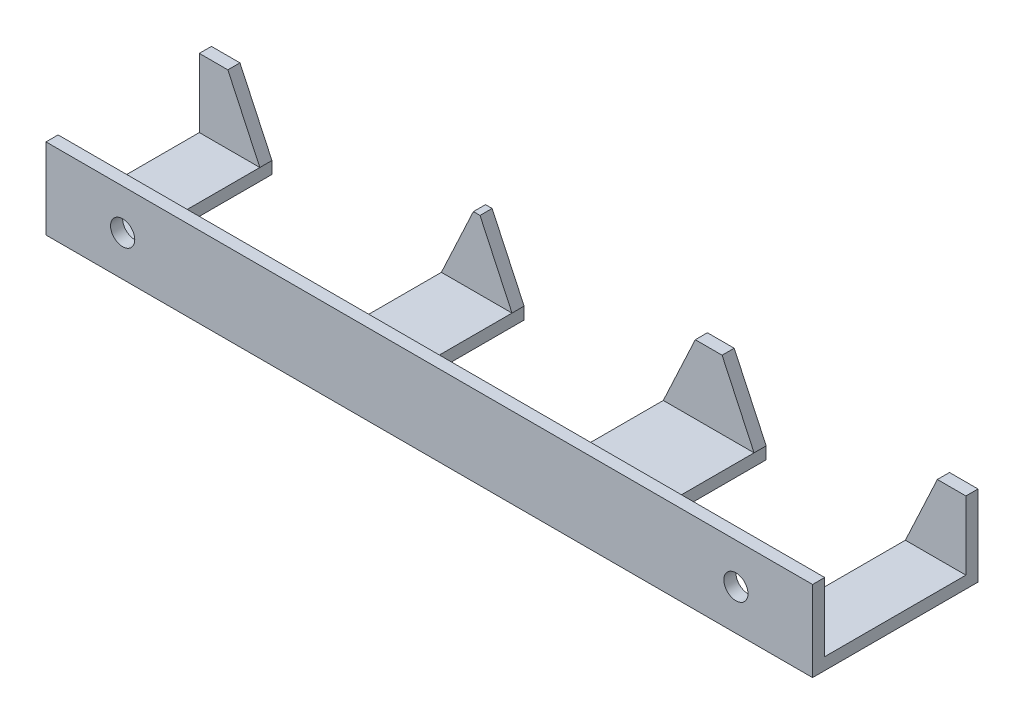
from build123d import *
from OCP.BRepFilletAPI import BRepFilletAPI_MakeChamfer

# Parameters (mm, degrees)
SKICA1_W                      = 190
SKICA1_H                      = 20
P_IDAT_VYSUNUT_M1_DEPTH       = 41
SKICA2_W                      = 95
SKICA2_H                      = 35
ODEBRAT_VYSUNUT_M1_DEPTH      = 17
SKICA3_W                      = 37.5
SKICA3_H                      = 20
SKICA3_W_2                    = 45
ODEBRAT_VYSUNUT_M2_DEPTH      = 38
D_RY_PRO_KOL_K_VELIKOST_MM1_D = 6
ZKOSEN_2_SIZE                 = 17
ZKOSEN_2_SIZE2                = 7.927230189
ZKOSEN_3_SIZE                 = 17
ZKOSEN_3_SIZE2                = 7.927230189


with BuildPart() as part:
    # Skica1 → Přidat vysunutím1 (new body)
    with BuildSketch(Plane.XY):
        Rectangle(SKICA1_W, SKICA1_H)
    extrude(amount=P_IDAT_VYSUNUT_M1_DEPTH)

    # Skica2 → Odebrat vysunutím1 (cut)
    with BuildSketch(Plane(origin=(0, 10, 0), x_dir=(1, 0, 0), z_dir=(0, 1, 0))):
        with Locations((-47.5, -20.5)):
            Rectangle(SKICA2_W, SKICA2_H)
        with Locations((47.5, -20.5)):
            Rectangle(SKICA2_W, SKICA2_H)
    extrude(amount=-ODEBRAT_VYSUNUT_M1_DEPTH, mode=Mode.SUBTRACT)

    # Skica3 → Odebrat vysunutím2 (cut)
    with BuildSketch(Plane(origin=(0, 0, 0), x_dir=(-1, 0, 0), z_dir=(0, 0, -1))):
        with Locations((-61.25, 0)):
            Rectangle(SKICA3_W, SKICA3_H)
        with Locations((-1.25, 0)):
            Rectangle(SKICA3_W, SKICA3_H)
        with Locations((57.5, 0)):
            Rectangle(SKICA3_W_2, SKICA3_H)
    extrude(amount=-ODEBRAT_VYSUNUT_M2_DEPTH, mode=Mode.SUBTRACT)

    # Díry pro kolík, velikost mm1 (through all)
    with Locations(Plane.XY.offset(41)):
        with Locations((-76, 0), (76, 0)):
            Hole(D_RY_PRO_KOL_K_VELIKOST_MM1_D / 2)

    # Zkosení2: one chamfer whose edges measure the first distance from different faces: ONE call of the kernel's chamfer builder (chamfer() names one face for all edges)
    zkosen_2_edges_1 = [part.edges().sort_by_distance(p)[0] for p in [
        (-35, 10, 1.5),
    ]]
    zkosen_2_side_1 = [part.faces().sort_by_distance(p)[0] for p in [
        (-35, 0, 0.429418211),
    ]]
    zkosen_2_edges_2 = [part.edges().sort_by_distance(p)[0] for p in [
        (20, 10, 1.5),
    ]]
    zkosen_2_side_2 = [part.faces().sort_by_distance(p)[0] for p in [
        (20, 0, 0.429418211),
    ]]
    zkosen_2_edges_3 = [part.edges().sort_by_distance(p)[0] for p in [
        (80, 10, 1.5),
    ]]
    zkosen_2_side_3 = [part.faces().sort_by_distance(p)[0] for p in [
        (80, 0, 0.429418211),
    ]]
    zkosen_2 = BRepFilletAPI_MakeChamfer(part.part.solid().wrapped)
    for e in zkosen_2_edges_1:
        zkosen_2.Add(ZKOSEN_2_SIZE, ZKOSEN_2_SIZE2, e.wrapped, zkosen_2_side_1[0].wrapped)  # the first distance lies on this face
    for e in zkosen_2_edges_2:
        zkosen_2.Add(ZKOSEN_2_SIZE, ZKOSEN_2_SIZE2, e.wrapped, zkosen_2_side_2[0].wrapped)  # the first distance lies on this face
    for e in zkosen_2_edges_3:
        zkosen_2.Add(ZKOSEN_2_SIZE, ZKOSEN_2_SIZE2, e.wrapped, zkosen_2_side_3[0].wrapped)  # the first distance lies on this face
    add(Compound.cast(zkosen_2.Shape()), mode=Mode.REPLACE)

    # Zkosení3: one chamfer whose edges measure the first distance from different faces: ONE call of the kernel's chamfer builder (chamfer() names one face for all edges)
    zkosen_3_edges_1 = [part.edges().sort_by_distance(p)[0] for p in [
        (-80, 10, 1.5),
    ]]
    zkosen_3_side_1 = [part.faces().sort_by_distance(p)[0] for p in [
        (-80, 0, 0.429418211),
    ]]
    zkosen_3_edges_2 = [part.edges().sort_by_distance(p)[0] for p in [
        (-17.5, 10, 1.5),
    ]]
    zkosen_3_side_2 = [part.faces().sort_by_distance(p)[0] for p in [
        (-17.5, 0, 0.429418211),
    ]]
    zkosen_3_edges_3 = [part.edges().sort_by_distance(p)[0] for p in [
        (42.5, 10, 1.5),
    ]]
    zkosen_3_side_3 = [part.faces().sort_by_distance(p)[0] for p in [
        (42.5, 0, 0.429418211),
    ]]
    zkosen_3 = BRepFilletAPI_MakeChamfer(part.part.solid().wrapped)
    for e in zkosen_3_edges_1:
        zkosen_3.Add(ZKOSEN_3_SIZE, ZKOSEN_3_SIZE2, e.wrapped, zkosen_3_side_1[0].wrapped)  # the first distance lies on this face
    for e in zkosen_3_edges_2:
        zkosen_3.Add(ZKOSEN_3_SIZE, ZKOSEN_3_SIZE2, e.wrapped, zkosen_3_side_2[0].wrapped)  # the first distance lies on this face
    for e in zkosen_3_edges_3:
        zkosen_3.Add(ZKOSEN_3_SIZE, ZKOSEN_3_SIZE2, e.wrapped, zkosen_3_side_3[0].wrapped)  # the first distance lies on this face
    add(Compound.cast(zkosen_3.Shape()), mode=Mode.REPLACE)


solid = part.part
